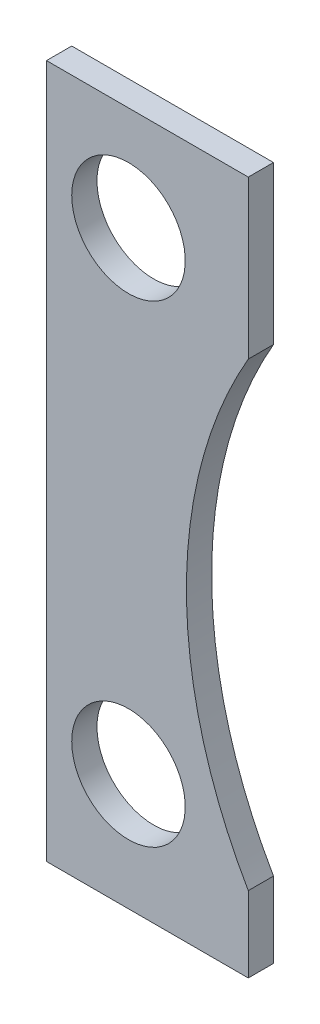
from build123d import *

# Parameters (mm, degrees)
Y_KSEKLIK_EKSTR_ZYON1_DEPTH = 2
IZIM2_R                     = 9
KES_EKSTR_ZYON1_DEPTH       = 115.629839047


with BuildPart() as part:
    # Çizim1 → Yükseklik-Ekstrüzyon1 (new, symmetric)
    with BuildSketch(Plane.XY):
        with BuildLine():
            Line((0, 110), (32, 110))
            Line((32, 110), (32, 85))
            ThreePointArc((32, 85), (22.190316578, 48.5), (32, 12))
            Line((32, 12), (32, 0))
            Line((32, 0), (0, 0))
            Line((0, 0), (0, 110))
        make_face()
    extrude(amount=Y_KSEKLIK_EKSTR_ZYON1_DEPTH, both=True)

    # Çizim2 → Kes-Ekstrüzyon1 (cut, through all)
    with BuildSketch(Plane(origin=(0, 0, -2), x_dir=(-1, 0, 0), z_dir=(0, 0, -1))):
        with Locations((-13, 93.5)):
            Circle(IZIM2_R)
        with Locations((-13, 18.5)):
            Circle(IZIM2_R)
    extrude(amount=-KES_EKSTR_ZYON1_DEPTH, mode=Mode.SUBTRACT)


solid = part.part
